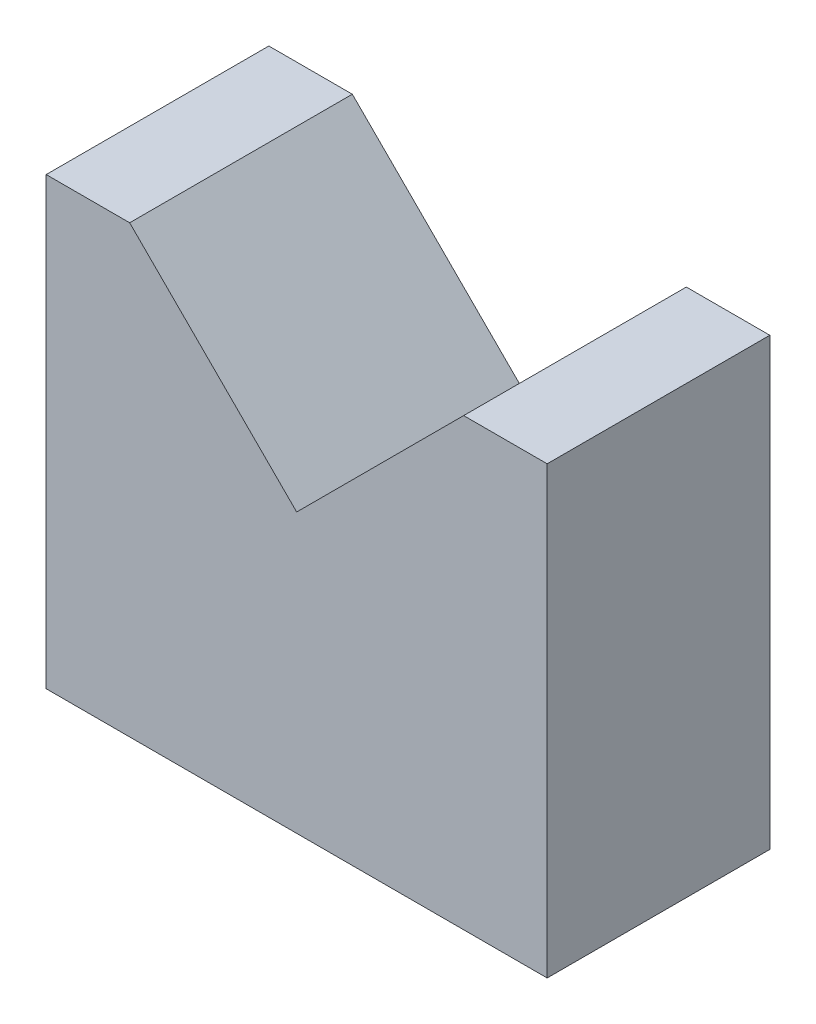
from build123d import *

# Parameters (mm, degrees)
BOSS_EXTRUDE1_DEPTH = 12.7


with BuildPart() as part:
    # Sketch1 → Boss-Extrude1 (new, symmetric)
    with BuildSketch(Plane.XY):
        Polygon((-28.575, 50.8), (-19.05, 50.8), (0, 31.75), (19.05, 50.8), (28.575, 50.8), (28.575, 0), (-28.575, 0), align=None)
    extrude(amount=BOSS_EXTRUDE1_DEPTH, both=True)


solid = part.part
